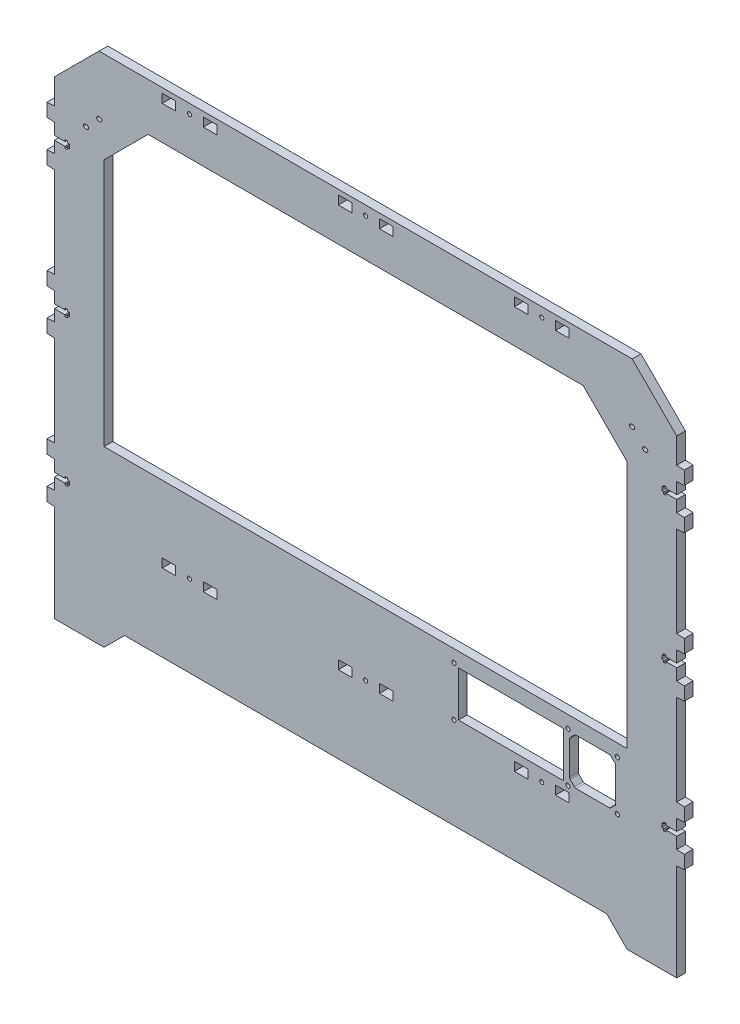
from build123d import *

# Parameters (mm, degrees)
SKETCH1_W           = 9.8
SKETCH1_H           = 6.4
SKETCH1_R           = 1.5
SKETCH1_R_2         = 1.55
SKETCH1_W_2         = 76.6
SKETCH1_H_2         = 33
BOSS_EXTRUDE1_DEPTH = 6.4


with BuildPart() as part:
    # Sketch1 → Boss-Extrude1 (new body)
    with BuildSketch(Plane.XY):
        Polygon((314.226902438, 50.624451725), (-74.782774982, 50.624451725), (-107.277936272, 18.129290435), (-107.277936272, -0.349868688), (-112.777936272, -0.624868688), (-112.777936272, -10.324868688), (-107.277936272, -10.599868688), (-107.277936272, -10.774868688), (-107.277936272, -18.974868688), (-99.577936272, -18.974868688), (-99.577936272, -17.724868688), (-97.777936272, -17.724868688), (-97.777936272, -18.974868688), (-96.377936272, -18.974868688), (-96.377936272, -21.976227862), (-97.777936272, -21.976227862), (-97.777936272, -23.224868688), (-99.577936272, -23.224868688), (-99.577936272, -21.976227862), (-107.277936272, -21.976227862), (-107.277936272, -30.174868688), (-107.277936272, -30.349868688), (-112.777936272, -30.624868688), (-112.777936272, -40.324868688), (-107.277936272, -40.599868688), (-107.277936272, -106.749868688), (-112.777936272, -107.024868688), (-112.777936272, -116.724868688), (-107.277936272, -116.999868688), (-107.277936272, -117.174868688), (-107.277936272, -125.374868688), (-99.577936272, -125.374868688), (-99.577936272, -124.124868688), (-97.777936272, -124.124868688), (-97.777936272, -125.374868688), (-96.377936272, -125.374868688), (-96.377936272, -128.376227862), (-97.777936272, -128.376227862), (-97.777936272, -129.624868688), (-99.577936272, -129.624868688), (-99.577936272, -128.376227862), (-107.277936272, -128.376227862), (-107.277936272, -136.574868688), (-107.277936272, -136.749868688), (-112.777936272, -137.024868688), (-112.777936272, -146.724868688), (-107.277936272, -146.999868688), (-107.277936272, -213.149868688), (-112.777936272, -213.424868688), (-112.777936272, -223.124868688), (-107.277936272, -223.399868688), (-107.277936272, -223.574868688), (-107.277936272, -231.774868688), (-99.577936272, -231.774868688), (-99.577936272, -230.524868688), (-97.777936272, -230.524868688), (-97.777936272, -231.774868688), (-96.377936272, -231.774868688), (-96.377936272, -234.776227862), (-97.777936272, -234.776227862), (-97.777936272, -236.024868688), (-99.577936272, -236.024868688), (-99.577936272, -234.776227862), (-107.277936272, -234.776227862), (-107.277936272, -242.974868688), (-107.277936272, -243.149868688), (-112.777936272, -243.424868688), (-112.777936272, -253.124868688), (-107.277936272, -253.399868688), (-107.277936272, -324.325548275), (-71.127936272, -324.325548275), (-56.129772096, -309.327384099), (295.573899552, -309.327384099), (310.572063728, -324.325548275), (346.722063728, -324.325548275), (346.722063728, -304.325548275), (346.722063728, -266.715548275), (346.722063728, -258.574868688), (346.722063728, -257.975548275), (346.722063728, -253.399868688), (352.222063728, -253.124868688), (352.222063728, -243.424868688), (346.722063728, -243.149868688), (346.722063728, -234.774868688), (339.022063728, -234.774868688), (339.022063728, -236.023509515), (337.222063728, -236.023509515), (337.222063728, -234.774868688), (335.822063728, -234.774868688), (335.822063728, -231.773509515), (337.222063728, -231.773509515), (337.222063728, -230.523509515), (339.022063728, -230.523509515), (339.022063728, -231.773509515), (346.723160406, -231.773509515), (346.722063728, -223.399868688), (352.222063728, -223.124868688), (352.222063728, -213.424868688), (346.722063728, -213.149868688), (346.722063728, -146.999868688), (352.222063728, -146.724868688), (352.222063728, -137.024868688), (346.722063728, -136.749868688), (346.722063728, -136.574868688), (346.722063728, -128.376227862), (339.022063728, -128.376227862), (339.022063728, -129.624868688), (337.222063728, -129.624868688), (337.222063728, -128.376227862), (335.822063728, -128.376227862), (335.822063728, -125.374868688), (337.222063728, -125.374868688), (337.222063728, -124.124868688), (339.022063728, -124.124868688), (339.022063728, -125.374868688), (346.722063728, -125.374868688), (346.722063728, -116.999868688), (352.222063728, -116.724868688), (352.222063728, -107.024868688), (346.722063728, -106.749868688), (346.722063728, -40.599868688), (352.222063728, -40.324868688), (352.222063728, -30.624868688), (346.722063728, -30.349868688), (346.722063728, -30.174868688), (346.722063728, -21.976227862), (339.022063728, -21.976227862), (339.022063728, -23.224868688), (337.222063728, -23.224868688), (337.222063728, -21.976227862), (335.822063728, -21.976227862), (335.822063728, -18.974868688), (337.222063728, -18.974868688), (337.222063728, -17.724868688), (339.022063728, -17.724868688), (339.022063728, -18.974868688), (346.722063728, -18.974868688), (346.722063728, -18.973509515), (346.722063728, -10.774868688), (346.722063728, -10.599868688), (352.222063728, -10.324868688), (352.222063728, -0.624868688), (346.722063728, -0.349868688), (346.722063728, 18.129290435), align=None)
        with Locations((-23.777936272, -249.775548275)):
            Rectangle(SKETCH1_W, SKETCH1_H, mode=Mode.SUBTRACT)
        with Locations((-8.777256685, -249.775548275)):
            Circle(SKETCH1_R, mode=Mode.SUBTRACT)
        with Locations((6.223422901, -249.775548275)):
            Rectangle(SKETCH1_W, SKETCH1_H, mode=Mode.SUBTRACT)
        with Locations((104.722063728, -249.775548275)):
            Rectangle(SKETCH1_W, SKETCH1_H, mode=Mode.SUBTRACT)
        with Locations((119.722743315, -249.775548275)):
            Circle(SKETCH1_R, mode=Mode.SUBTRACT)
        with Locations((134.723422901, -249.775548275)):
            Rectangle(SKETCH1_W, SKETCH1_H, mode=Mode.SUBTRACT)
        with Locations((184.162063728, -242.475548275)):
            Circle(SKETCH1_R_2, mode=Mode.SUBTRACT)
        with Locations((233.222063728, -249.775548275)):
            Rectangle(SKETCH1_W, SKETCH1_H, mode=Mode.SUBTRACT)
        with Locations((248.222743315, -249.775548275)):
            Circle(SKETCH1_R, mode=Mode.SUBTRACT)
        with Locations((263.223422901, -249.775548275)):
            Rectangle(SKETCH1_W, SKETCH1_H, mode=Mode.SUBTRACT)
        with Locations((267.362063728, -242.475548275)):
            Circle(SKETCH1_R_2, mode=Mode.SUBTRACT)
        with Locations((303.362063728, -242.475548275)):
            Circle(SKETCH1_R_2, mode=Mode.SUBTRACT)
        with Locations((225.762063728, -224.475548275)):
            Rectangle(SKETCH1_W_2, SKETCH1_H_2, mode=Mode.SUBTRACT)
        with Locations((184.162063728, -206.475548275)):
            Circle(SKETCH1_R_2, mode=Mode.SUBTRACT)
        with BuildLine():
            Line((273.266584787, -207.612908013), (297.458243085, -207.612908013))
            ThreePointArc((297.458243085, -207.612908013), (298.127939091, -207.746118832), (298.695679952, -208.125471146))
            Line((298.695679952, -208.125471146), (301.712350803, -211.142141997))
            ThreePointArc((301.712350803, -211.142141997), (302.091703118, -211.709882858), (302.224913936, -212.379578865))
            Line((302.224913936, -212.379578865), (302.224913936, -236.571237162))
            ThreePointArc((302.224913936, -236.571237162), (302.091703118, -237.240933169), (301.712350803, -237.808674029))
            Line((301.712350803, -237.808674029), (298.695679952, -240.825344881))
            ThreePointArc((298.695679952, -240.825344881), (298.127939091, -241.204697195), (297.458243085, -241.337908013))
            Line((297.458243085, -241.337908013), (273.266584787, -241.337908013))
            ThreePointArc((273.266584787, -241.337908013), (272.59688878, -241.204697195), (272.02914792, -240.825344881))
            Line((272.02914792, -240.825344881), (269.012477069, -237.808674029))
            ThreePointArc((269.012477069, -237.808674029), (268.633124754, -237.240933169), (268.499913936, -236.571237162))
            Line((268.499913936, -236.571237162), (268.499913936, -212.379578865))
            ThreePointArc((268.499913936, -212.379578865), (268.633124754, -211.709882858), (269.012477069, -211.142141997))
            Line((269.012477069, -211.142141997), (272.02914792, -208.125471146))
            ThreePointArc((272.02914792, -208.125471146), (272.59688878, -207.746118832), (273.266584787, -207.612908013))
        make_face(mode=Mode.SUBTRACT)
        with Locations((267.362063728, -206.475548275)):
            Circle(SKETCH1_R_2, mode=Mode.SUBTRACT)
        with Locations((303.362063728, -206.475548275)):
            Circle(SKETCH1_R_2, mode=Mode.SUBTRACT)
        Polygon((-38.999772096, 15.874451725), (278.443899552, 15.874451725), (310.572063728, -16.253712451), (310.572063728, -197.475548275), (-71.127936272, -197.475548275), (-71.127936272, -16.253712451), align=None, mode=Mode.SUBTRACT)
        with BuildLine():
            ThreePointArc((-84.652936272, -3.425548275), (-86.152936272, -1.925548275), (-84.652936272, -0.425548275))
            Line((-84.652936272, -0.425548275), (-83.852936272, -0.425548275))
            ThreePointArc((-83.852936272, -0.425548275), (-82.352936272, -1.925548275), (-83.852936272, -3.425548275))
            Line((-83.852936272, -3.425548275), (-84.652936272, -3.425548275))
        make_face(mode=Mode.SUBTRACT)
        with BuildLine():
            Line((-74.252936272, 6.174451725), (-75.052936272, 6.174451725))
            ThreePointArc((-75.052936272, 6.174451725), (-76.552936272, 7.674451725), (-75.052936272, 9.174451725))
            Line((-75.052936272, 9.174451725), (-74.252936272, 9.174451725))
            ThreePointArc((-74.252936272, 9.174451725), (-72.649606634, 7.674451725), (-74.252936272, 6.174451725))
        make_face(mode=Mode.SUBTRACT)
        with Locations((-23.777936272, 43.824451725)):
            Rectangle(SKETCH1_W, SKETCH1_H, mode=Mode.SUBTRACT)
        with Locations((-8.777256685, 43.824451725)):
            Circle(SKETCH1_R, mode=Mode.SUBTRACT)
        with Locations((6.223422901, 43.824451725)):
            Rectangle(SKETCH1_W, SKETCH1_H, mode=Mode.SUBTRACT)
        with Locations((104.722063728, 43.824451725)):
            Rectangle(SKETCH1_W, SKETCH1_H, mode=Mode.SUBTRACT)
        with Locations((119.722743315, 43.824451725)):
            Circle(SKETCH1_R, mode=Mode.SUBTRACT)
        with Locations((134.723422901, 43.824451725)):
            Rectangle(SKETCH1_W, SKETCH1_H, mode=Mode.SUBTRACT)
        with Locations((233.222063728, 43.824451725)):
            Rectangle(SKETCH1_W, SKETCH1_H, mode=Mode.SUBTRACT)
        with BuildLine():
            Line((323.297063728, -0.425548275), (324.097063728, -0.425548275))
            ThreePointArc((324.097063728, -0.425548275), (325.597063728, -1.925548275), (324.097063728, -3.425548275))
            Line((324.097063728, -3.425548275), (323.297063728, -3.425548275))
            ThreePointArc((323.297063728, -3.425548275), (321.797063728, -1.925548275), (323.297063728, -0.425548275))
        make_face(mode=Mode.SUBTRACT)
        with Locations((248.222743315, 43.824451725)):
            Circle(SKETCH1_R, mode=Mode.SUBTRACT)
        with Locations((263.223422901, 43.824451725)):
            Rectangle(SKETCH1_W, SKETCH1_H, mode=Mode.SUBTRACT)
        with BuildLine():
            Line((313.697063728, 9.174451725), (314.497063728, 9.174451725))
            ThreePointArc((314.497063728, 9.174451725), (315.997063728, 7.674451725), (314.497063728, 6.174451725))
            Line((314.497063728, 6.174451725), (313.697063728, 6.174451725))
            ThreePointArc((313.697063728, 6.174451725), (312.197063728, 7.674451725), (313.697063728, 9.174451725))
        make_face(mode=Mode.SUBTRACT)
    extrude(amount=BOSS_EXTRUDE1_DEPTH)


solid = part.part
